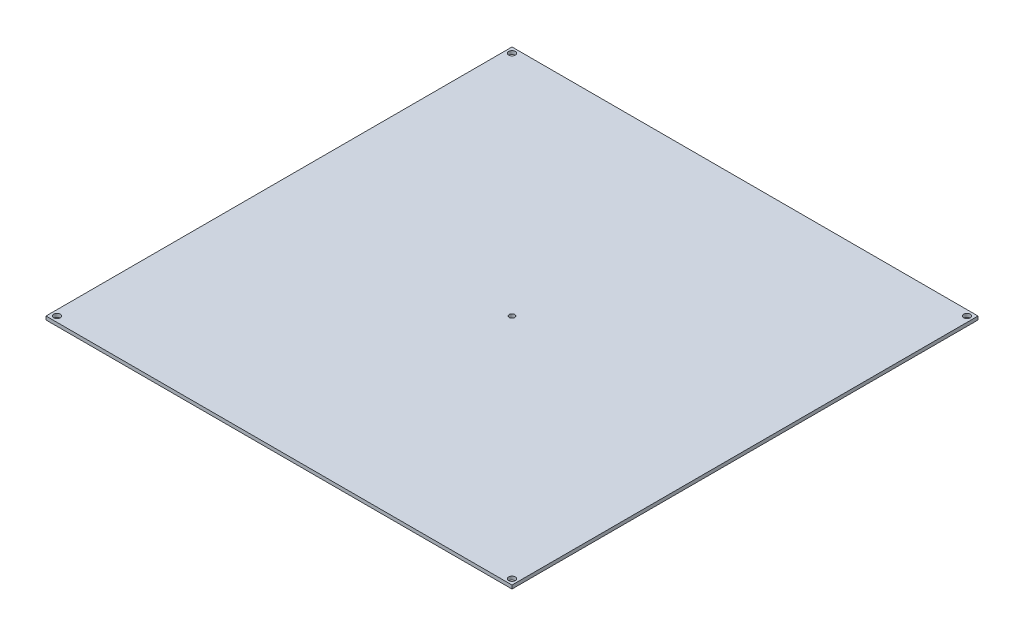
from build123d import *

# Parameters (mm, degrees)
SKETCH1_W           = 214
SKETCH1_H           = 214
BOSS_EXTRUDE1_DEPTH = 1.6
SKETCH2_R           = 1.5
SKETCH2_R_2         = 1.25
CUT_EXTRUDE1_DEPTH  = 152.329309785


with BuildPart() as part:
    # Sketch1 → Boss-Extrude1 (new body)
    with BuildSketch(Plane(origin=(0, 0, 0), x_dir=(1, 0, 0), z_dir=(0, 1, 0))):
        Rectangle(SKETCH1_W, SKETCH1_H)
    extrude(amount=BOSS_EXTRUDE1_DEPTH)

    # Sketch2 → Cut-Extrude1 (cut, through all)
    with BuildSketch(Plane(origin=(0, 1.6, 0), x_dir=(1, 0, 0), z_dir=(0, 1, 0))):
        with Locations(Location((-104.5, 104.5, 0), (0, 0, 270))):
            Circle(SKETCH2_R)
        with Locations(Location((104.5, 104.5, 0), (0, 0, 90))):
            Circle(SKETCH2_R)
        with Locations(Location((104.5, -104.5, 0), (0, 0, 270))):
            Circle(SKETCH2_R)
        with Locations(Location((-104.5, -104.5, 0), (0, 0, 90))):
            Circle(SKETCH2_R)
        with Locations(Location((0, 0, 0), (0, 0, 270))):
            Circle(SKETCH2_R_2)
    extrude(amount=-CUT_EXTRUDE1_DEPTH, mode=Mode.SUBTRACT)


solid = part.part
